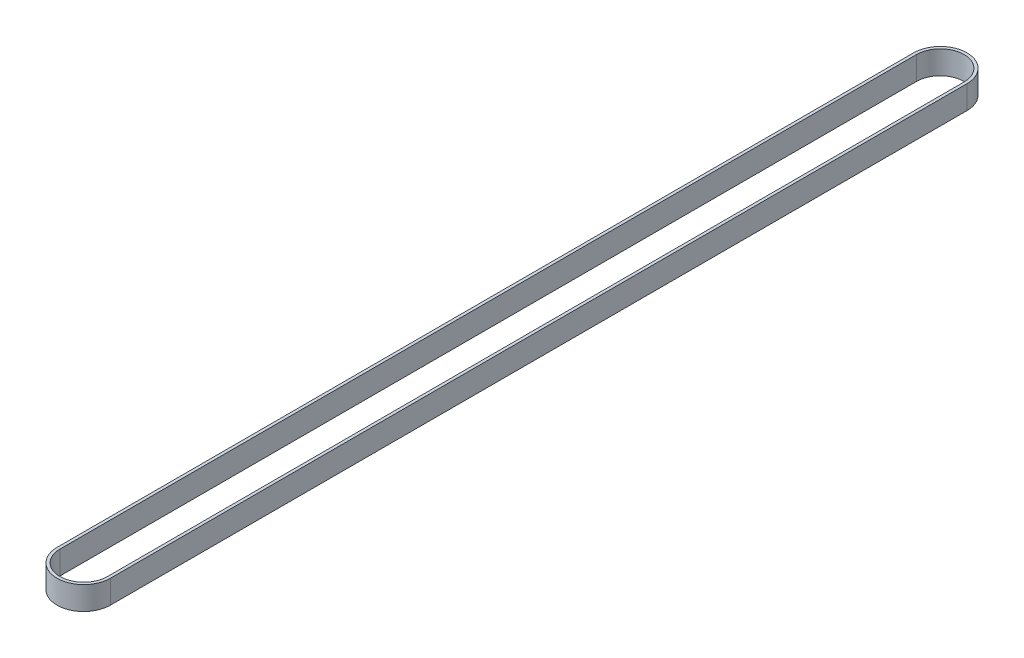
from build123d import *

# Parameters (mm, degrees)
EXTRUDE_1_DEPTH = 6


with BuildPart() as part:
    # 草图1 → 凸台-拉伸1 (new body)
    with BuildSketch(Plane(origin=(0, 0, 0), x_dir=(1, 0, 0), z_dir=(0, 1, 0))):
        with BuildLine():
            Line((-6.86, -110.05), (-6.86, 110.05))
            ThreePointArc((-6.86, 110.05), (0, 116.91), (6.86, 110.05))
            Line((6.86, 110.05), (6.86, -110.05))
            ThreePointArc((6.86, -110.05), (0, -116.91), (-6.86, -110.05))
        make_face()
        with BuildLine():
            Line((-6.11, -110.05), (-6.11, 110.05))
            ThreePointArc((-6.11, 110.05), (0, 116.16), (6.11, 110.05))
            Line((6.11, 110.05), (6.11, -110.05))
            ThreePointArc((6.11, -110.05), (0, -116.16), (-6.11, -110.05))
        make_face(mode=Mode.SUBTRACT)
    extrude(amount=EXTRUDE_1_DEPTH)


solid = part.part
